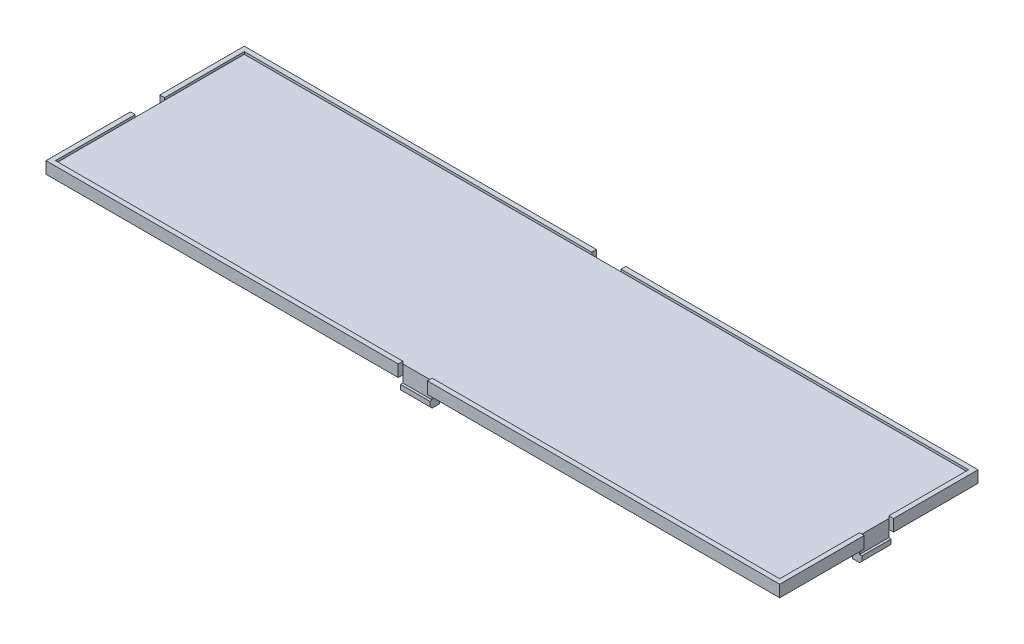
from build123d import *

# Parameters (mm, degrees)
SKETCH_1_W          = 155.4
SKETCH_1_H          = 42
EXTRUDE_1_DEPTH     = 2.5
SKETCH_2_W          = 153.4
SKETCH_2_H          = 40
CUT_EXTRUDE_1_DEPTH = 0.5
SKETCH_3_W          = 1
SKETCH_3_H          = 6.2
SKETCH_3_W_2        = 6.2
SKETCH_3_H_2        = 1
CUT_EXTRUDE_2_DEPTH = 81.526641554
SKETCH_4_W          = 2
SKETCH_4_H          = 6.2
SKETCH_4_W_2        = 6.2
SKETCH_4_H_2        = 1.5
SKETCH_4_W_3        = 1.5
EXTRUDE_2_DEPTH     = 3
EXTRUDE_3_DEPTH     = 6.2
EXTRUDE_4_DEPTH     = 6.2


with BuildPart() as part:
    # Эскиз1 → Бобышка-Вытянуть1 (new body)
    with BuildSketch(Plane(origin=(0, 0, 0), x_dir=(1, 0, 0), z_dir=(0, 1, 0))):
        Rectangle(SKETCH_1_W, SKETCH_1_H)
    extrude(amount=EXTRUDE_1_DEPTH)

    # Эскиз2 → Вырез-Вытянуть1 (cut)
    with BuildSketch(Plane(origin=(0, 2.5, 0), x_dir=(1, 0, 0), z_dir=(0, 1, 0))):
        Rectangle(SKETCH_2_W, SKETCH_2_H)
    extrude(amount=-CUT_EXTRUDE_1_DEPTH, mode=Mode.SUBTRACT)

    # Эскиз3 → Вырез-Вытянуть2 (cut, through all)
    with BuildSketch(Plane(origin=(0, 2.5, 0), x_dir=(1, 0, 0), z_dir=(0, 1, 0))):
        with Locations((-77.2, 0)):
            Rectangle(SKETCH_3_W, SKETCH_3_H)
        with Locations((0, 20.5)):
            Rectangle(SKETCH_3_W_2, SKETCH_3_H_2)
        with Locations((0, -20.5)):
            Rectangle(SKETCH_3_W_2, SKETCH_3_H_2)
        with Locations((77.2, 0)):
            Rectangle(SKETCH_3_W, SKETCH_3_H)
    extrude(amount=-CUT_EXTRUDE_2_DEPTH, mode=Mode.SUBTRACT)

    # Эскиз4 → Бобышка-Вытянуть2 (add)
    with BuildSketch(Plane.XZ):
        with Locations((-75.7, 0)):
            Rectangle(SKETCH_4_W, SKETCH_4_H)
        with Locations((0, 19.25)):
            Rectangle(SKETCH_4_W_2, SKETCH_4_H_2)
        with Locations((0, -19.25)):
            Rectangle(SKETCH_4_W_2, SKETCH_4_H_2)
        with Locations((75.95, 0)):
            Rectangle(SKETCH_4_W_3, SKETCH_4_H)
    extrude(amount=EXTRUDE_2_DEPTH)

    # Эскиз6 → Бобышка-Вытянуть3 (add)
    with BuildSketch(Plane.XY.offset(3.1)):
        Polygon((-76.7, -3), (-77.2, -2.5), (-77.2, -1.5), (-76.6, -1.5), (-76.6, -3), align=None)
    extrude_3 = extrude(amount=-EXTRUDE_3_DEPTH)

    # Зеркальное отражение1: Бобышка-Вытянуть3 across plane
    add(extrude_3.mirror(Plane(origin=(0, 0, 0), x_dir=(0, 0, 1), z_dir=(1, 0, 0))))

    # Эскиз8 → Бобышка-Вытянуть4 (add)
    with BuildSketch(Plane(origin=(3.1, 0, 0), x_dir=(0, 0, -1), z_dir=(1, 0, 0))):
        Polygon((-20, -3), (-20.5, -2.5), (-20.5, -1.5), (-19.9, -1.5), (-19.9, -3), align=None)
    extrude_4 = extrude(amount=-EXTRUDE_4_DEPTH)

    # Зеркальное отражение2: Бобышка-Вытянуть4 across plane
    add(extrude_4.mirror(Plane.XY))


solid = part.part
